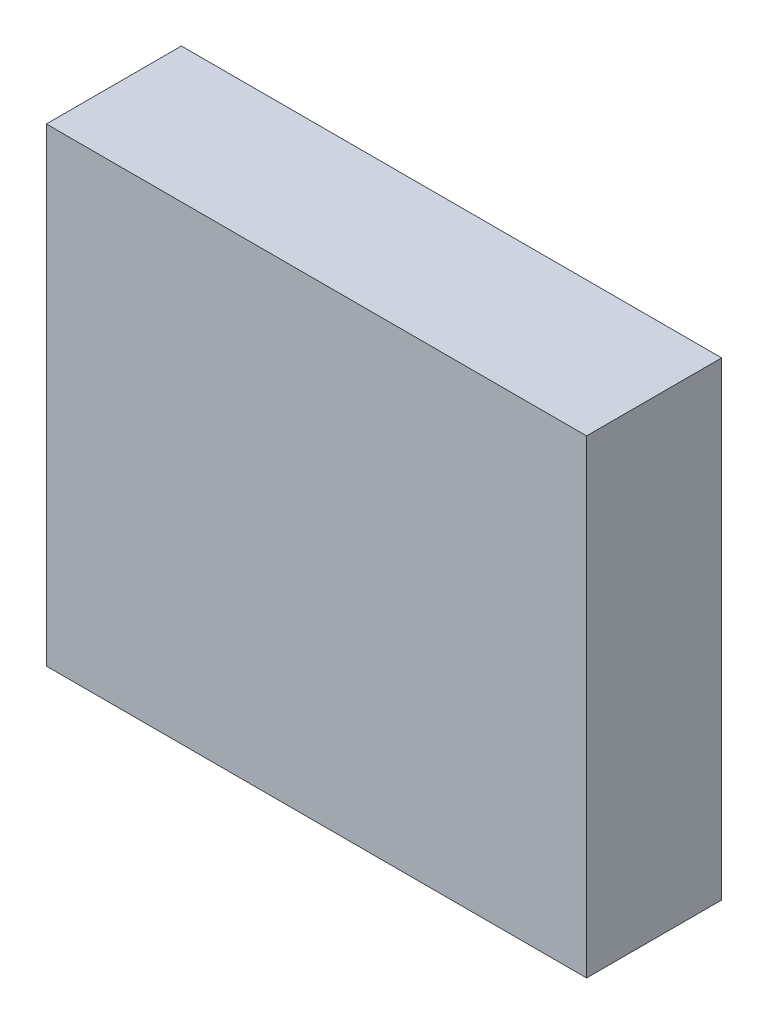
from build123d import *

# Parameters (mm, degrees)
SKETCH_1_W      = 84
SKETCH_1_H      = 73
EXTRUDE_1_DEPTH = 21


with BuildPart() as part:
    # 草图1 → 凸台-拉伸1 (new body)
    with BuildSketch(Plane.XY):
        Rectangle(SKETCH_1_W, SKETCH_1_H)
    extrude(amount=EXTRUDE_1_DEPTH)


solid = part.part
